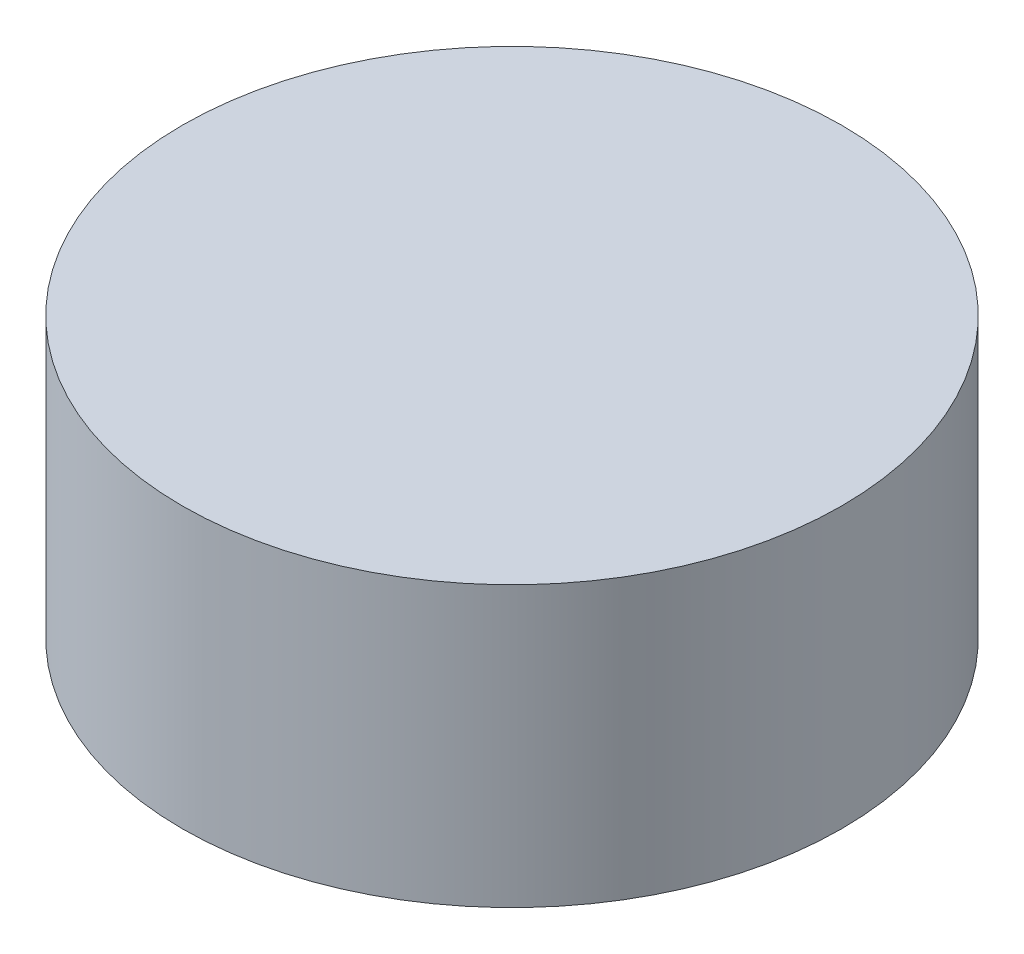
from build123d import *


with BuildPart() as part:
    # Sketch1 → Revolve1 (revolve)
    with BuildSketch(Plane(origin=(0, 0, 0), x_dir=(0, 0, -1), z_dir=(1, 0, 0))):
        Polygon((-562.5, 225), (-562.5, -225), (0, -225), (0, -185), (0, 225), (0, 252.019037432), (-562.5, 252.019037432), align=None)
        Polygon((-30, -190), (-220, -190), (-220, -215), (-275, -215), (-275, -190), (-537.5, -190), (-537.5, 185), (-537.5, 225), (-30, 225), (-30, 185), align=None, mode=Mode.SUBTRACT)
    revolve(axis=Axis((0, 225, 0), (0, -1, 0)))


solid = part.part
